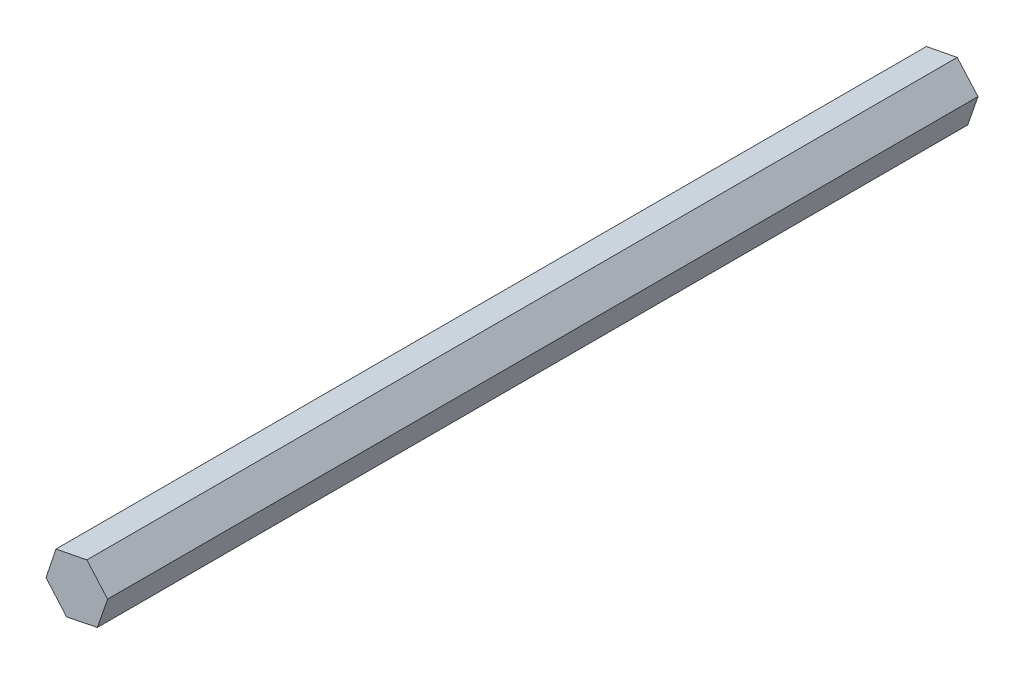
from build123d import *

# Parameters (mm, degrees)
BOSS_EXTRUDE1_DEPTH = 203.2


with BuildPart() as part:
    # Sketch1 → Boss-Extrude1 (new body)
    with BuildSketch(Plane(origin=(0, 0, -228.6), x_dir=(-1, 0, 0), z_dir=(0, 0, -1))):
        Polygon((-2.35748511, 6.924711439), (-7.209939519, 1.427489097), (-4.818233465, -5.503997714), (2.368727938, -6.957735332), (7.175718575, -1.420713725), (4.841211581, 5.530246234), align=None)
    extrude(amount=-BOSS_EXTRUDE1_DEPTH)


solid = part.part
